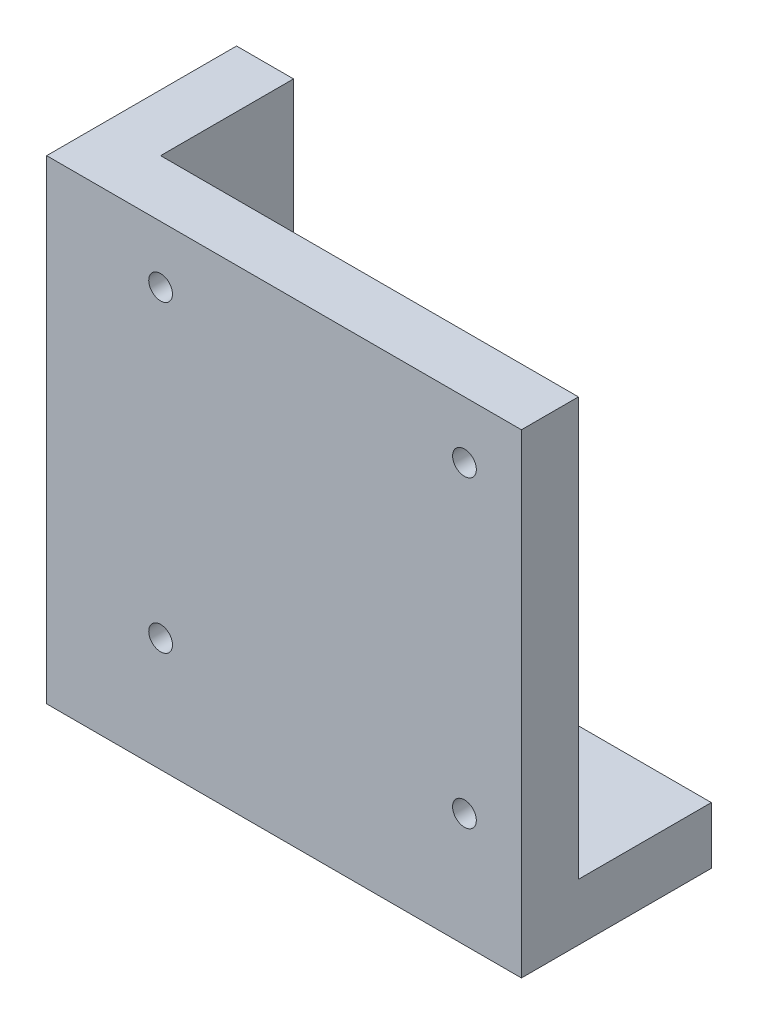
from build123d import *

# Parameters (mm, degrees)
SKETCH1_W           = 50
SKETCH1_H           = 20
BOSS_EXTRUDE1_DEPTH = 6
SKETCH2_W           = 6
SKETCH2_H           = 20
BOSS_EXTRUDE2_DEPTH = 44
SKETCH3_W           = 44
SKETCH3_H           = 6
BOSS_EXTRUDE3_DEPTH = 44
SKETCH4_R           = 1.25
CUT_EXTRUDE1_DEPTH  = 44


with BuildPart() as part:
    # Sketch1 → Boss-Extrude1 (new body)
    with BuildSketch(Plane(origin=(0, 0, 0), x_dir=(1, 0, 0), z_dir=(0, 1, 0))):
        with Locations((3.682170543, -4.379844961)):
            Rectangle(SKETCH1_W, SKETCH1_H)
    extrude(amount=BOSS_EXTRUDE1_DEPTH)

    # Sketch2 → Boss-Extrude2 (add)
    with BuildSketch(Plane(origin=(0, 6, 0), x_dir=(1, 0, 0), z_dir=(0, 1, 0))):
        with Locations((-18.317829457, -4.379844961)):
            Rectangle(SKETCH2_W, SKETCH2_H)
    extrude(amount=BOSS_EXTRUDE2_DEPTH)

    # Sketch3 → Boss-Extrude3 (add)
    with BuildSketch(Plane(origin=(0, 6, 0), x_dir=(1, 0, 0), z_dir=(0, 1, 0))):
        with Locations((6.682170543, -11.379844961)):
            Rectangle(SKETCH3_W, SKETCH3_H)
    extrude(amount=BOSS_EXTRUDE3_DEPTH)

    # Sketch4 → Cut-Extrude1 (cut)
    with BuildSketch(Plane(origin=(0, 0, 8.379844961), x_dir=(-1, 0, 0), z_dir=(0, 0, -1))):
        with Locations((-22.682170543, 44)):
            Circle(SKETCH4_R)
        with Locations((9.317829457, 44)):
            Circle(SKETCH4_R)
        with Locations((-22.682170543, 12)):
            Circle(SKETCH4_R)
        with Locations((9.317829457, 12)):
            Circle(SKETCH4_R)
    extrude(amount=-CUT_EXTRUDE1_DEPTH, mode=Mode.SUBTRACT)


solid = part.part
